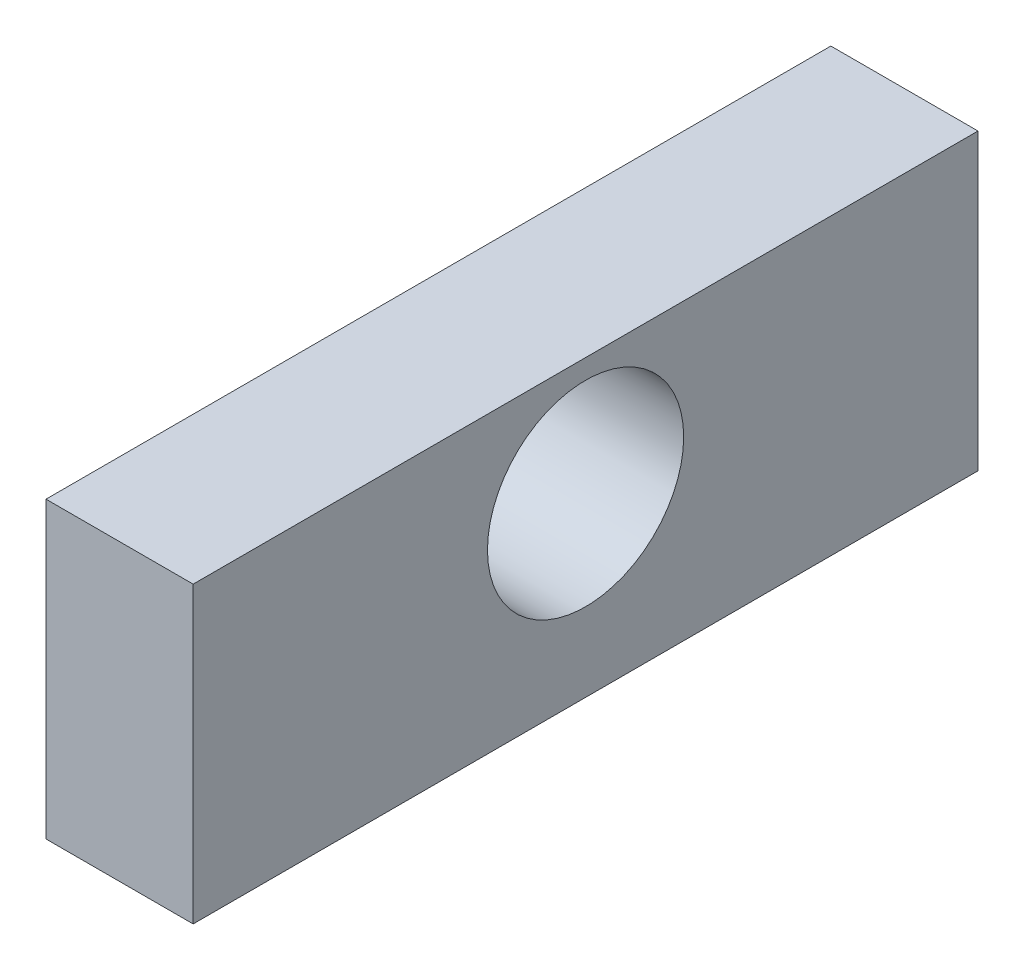
from build123d import *

# Parameters (mm, degrees)
SKETCH1_W                      = 50.8
SKETCH1_H                      = 19.05
BOSS_EXTRUDE1_DEPTH            = 9.525
F_1_2_0_5_DIAMETER_HOLE1_D     = 12.7
F_1_2_0_5_DIAMETER_HOLE1_DEPTH = 70.104
F_1_2_0_5_DIAMETER_HOLE1_TIP   = 3.815464931
F_10_32_TAPPED_HOLE1_D         = 4.0386
F_10_32_TAPPED_HOLE1_DEPTH     = 11.938
F_10_32_TAPPED_HOLE1_TIP       = 1.213317848


with BuildPart() as part:
    # Sketch1 → Boss-Extrude1 (new body)
    with BuildSketch(Plane(origin=(0, 0, 0), x_dir=(0, 0, -1), z_dir=(1, 0, 0))):
        Rectangle(SKETCH1_W, SKETCH1_H)
    extrude(amount=BOSS_EXTRUDE1_DEPTH)

    # 1/2 (0.5) Diameter Hole1
    with Locations(Plane(origin=(9.525, 0, 0), x_dir=(0, 0, -1), z_dir=(1, 0, 0))):
        with Locations((0, 1.905)):
            Hole(F_1_2_0_5_DIAMETER_HOLE1_D / 2, depth=F_1_2_0_5_DIAMETER_HOLE1_DEPTH)
            with Locations((0, 0, -(F_1_2_0_5_DIAMETER_HOLE1_DEPTH + F_1_2_0_5_DIAMETER_HOLE1_TIP / 2))):  # 118° drill point
                Cone(0, F_1_2_0_5_DIAMETER_HOLE1_D / 2, F_1_2_0_5_DIAMETER_HOLE1_TIP, mode=Mode.SUBTRACT)

    # #10-32 Tapped Hole1
    with Locations(Plane(origin=(-1.136463696, 0.51181849, -25.4), x_dir=(-1, 0, 0), z_dir=(0, 0, -1))):
        with Locations((-5.898963696, -3.68681849), (-5.898963696, 5.20318151)):
            Hole(F_10_32_TAPPED_HOLE1_D / 2, depth=F_10_32_TAPPED_HOLE1_DEPTH)
            with Locations((0, 0, -(F_10_32_TAPPED_HOLE1_DEPTH + F_10_32_TAPPED_HOLE1_TIP / 2))):  # 118° drill point
                Cone(0, F_10_32_TAPPED_HOLE1_D / 2, F_10_32_TAPPED_HOLE1_TIP, mode=Mode.SUBTRACT)


solid = part.part
